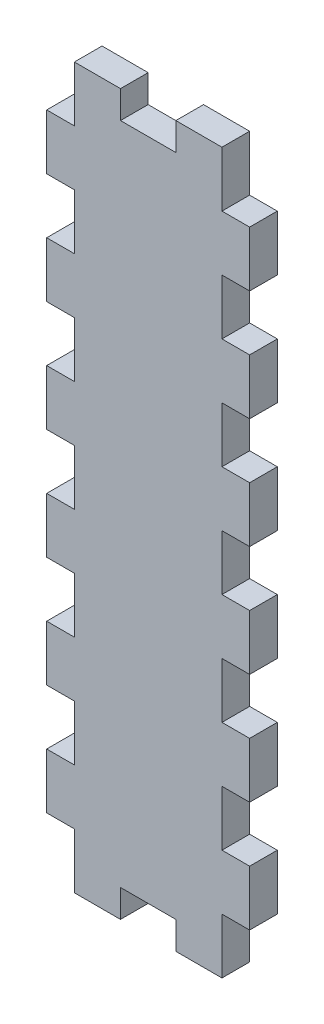
from build123d import *

# Parameters (mm, degrees)
EXTRUDE_1_DEPTH = 3


with BuildPart() as part:
    # 草图2 → 凸台-拉伸1 (new body)
    with BuildSketch(Plane.XY):
        Polygon((67, 81), (67, 75), (64, 75), (64, 69), (67, 69), (67, 63), (64, 63), (64, 57), (67, 57), (67, 51), (64, 51), (64, 45), (67, 45), (67, 39), (64, 39), (64, 33), (67, 33), (67, 27), (64, 27), (64, 21), (67, 21), (67, 15), (64, 15), (64, 9), (67, 9), (67, 3), (72, 3), (72, 6), (78, 6), (78, 3), (83, 3), (83, 9), (86, 9), (86, 15), (83, 15), (83, 21), (86, 21), (86, 27), (83, 27), (83, 33), (86, 33), (86, 39), (83, 39), (83, 45), (86, 45), (86, 51), (83, 51), (83, 57), (86, 57), (86, 63), (83, 63), (83, 69), (86, 69), (86, 75), (83, 75), (83, 81), (78, 81), (78, 78), (72, 78), (72, 81), align=None)
    extrude(amount=EXTRUDE_1_DEPTH)


solid = part.part
